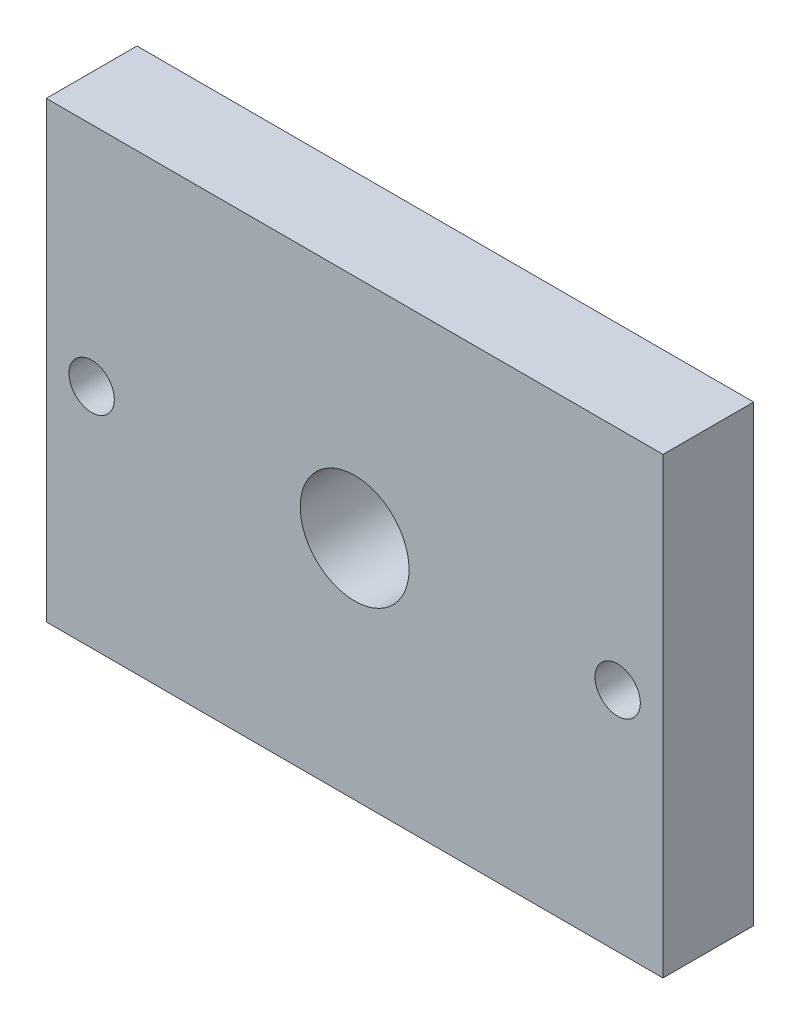
from build123d import *

# Parameters (mm, degrees)
SKETCH1_W           = 68
SKETCH1_H           = 50
SKETCH1_R           = 6
SKETCH1_R_2         = 2.5
BOSS_EXTRUDE1_DEPTH = 10


with BuildPart() as part:
    # Sketch1 → Boss-Extrude1 (new body)
    with BuildSketch(Plane.XY):
        Rectangle(SKETCH1_W, SKETCH1_H)
        Circle(SKETCH1_R, mode=Mode.SUBTRACT)
        with Locations((29, 0)):
            Circle(SKETCH1_R_2, mode=Mode.SUBTRACT)
        with Locations((-29, 0)):
            Circle(SKETCH1_R_2, mode=Mode.SUBTRACT)
    extrude(amount=BOSS_EXTRUDE1_DEPTH)


solid = part.part
